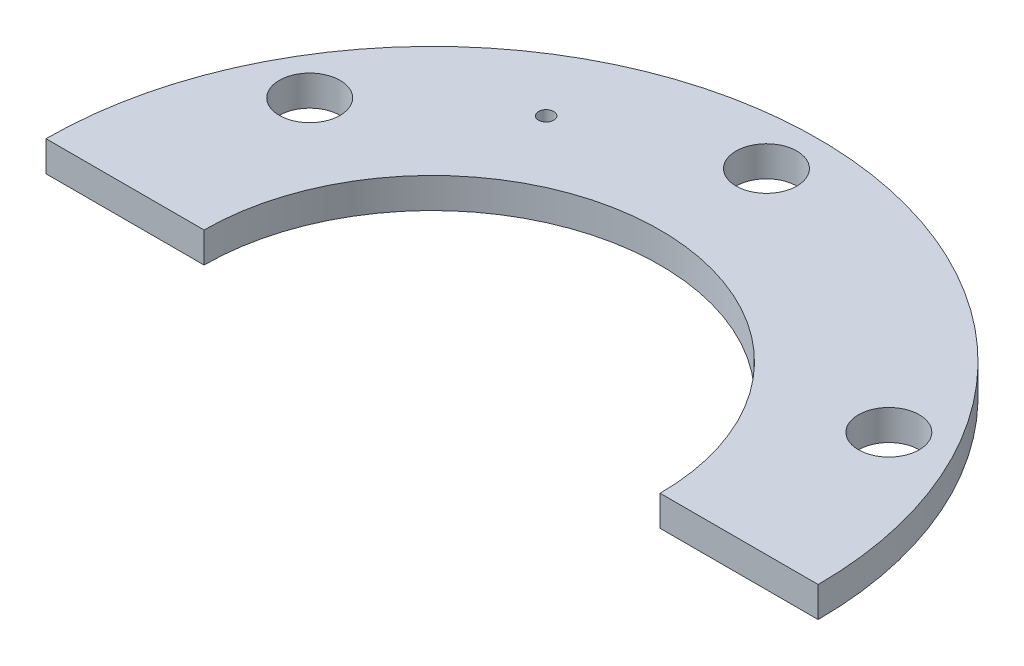
from build123d import *

# Parameters (mm, degrees)
SKETCH1_R               = 12.7
BOSS_EXTRUDE1_DEPTH     = 1
CUT_EXTRUDE1_DEPTH      = 18.98832955
CUT_EXTRUDE1_DEPTH_BACK = 18.98832955
SKETCH19_R              = 1
CUT_EXTRUDE2_DEPTH      = 18.98832955
CUT_EXTRUDE2_DEPTH_BACK = 18.98832955
SKETCH20_R              = 7.5
SKETCH21_W              = 65.874202484
SKETCH21_H              = 51.979273979
CUT_EXTRUDE3_DEPTH      = 18.98832955
CUT_EXTRUDE4_DEPTH      = 18.98832955
CUT_EXTRUDE4_DEPTH_BACK = 18.98832955
SKETCH22_R              = 0.25


with BuildPart() as part:
    # Sketch1 → Boss-Extrude1 (new body)
    with BuildSketch(Plane(origin=(0, 0, 0), x_dir=(1, 0, 0), z_dir=(0, 1, 0))):
        with Locations(Location((0, 0, 0), (0, 0, 270))):
            Circle(SKETCH1_R)
    extrude(amount=BOSS_EXTRUDE1_DEPTH)

    # Sketch19 → Cut-Extrude1 (cut, two sides: drawn at the far end of the back side and taken through both)
    with BuildSketch(Plane(origin=(0, 1, 0), x_dir=(1, 0, 0), z_dir=(0, 1, 0)).offset(-CUT_EXTRUDE1_DEPTH_BACK)):
        with Locations(Location((0, 11, 0), (0, 0, 270))):
            Circle(SKETCH19_R)
        with Locations(Location((9.526279442, 5.5, 0), (0, 0, 270))):
            Circle(SKETCH19_R)
        with Locations(Location((9.526279442, -5.5, 0), (0, 0, 270))):
            Circle(SKETCH19_R)
        with Locations(Location((0, -11, 0), (0, 0, 270))):
            Circle(SKETCH19_R)
        with Locations(Location((-9.526279442, -5.5, 0), (0, 0, 270))):
            Circle(SKETCH19_R)
        with Locations(Location((-9.526279442, 5.5, 0), (0, 0, 270))):
            Circle(SKETCH19_R)
    extrude(amount=CUT_EXTRUDE1_DEPTH + CUT_EXTRUDE1_DEPTH_BACK, mode=Mode.SUBTRACT)

    # Sketch20 → Cut-Extrude2 (cut, two sides: drawn at the far end of the back side and taken through both)
    with BuildSketch(Plane(origin=(0, 1, 0), x_dir=(1, 0, 0), z_dir=(0, 1, 0)).offset(-CUT_EXTRUDE2_DEPTH_BACK)):
        with Locations(Location((0, 0, 0), (0, 0, 270))):
            Circle(SKETCH20_R)
    extrude(amount=CUT_EXTRUDE2_DEPTH + CUT_EXTRUDE2_DEPTH_BACK, mode=Mode.SUBTRACT)

    # Sketch21 → Cut-Extrude3 (cut, through all)
    with BuildSketch(Plane.XY):
        with Locations((-3.816154381, 6.321647006)):
            Rectangle(SKETCH21_W, SKETCH21_H)
    extrude(amount=CUT_EXTRUDE3_DEPTH, mode=Mode.SUBTRACT)

    # Sketch22 → Cut-Extrude4 (cut, two sides: drawn at the far end of the back side and taken through both)
    with BuildSketch(Plane(origin=(0, 1, 0), x_dir=(1, 0, 0), z_dir=(0, 1, 0)).offset(-CUT_EXTRUDE4_DEPTH_BACK)):
        with Locations(Location((-5.125, 8.876760389, 0), (0, 0, 270))):
            Circle(SKETCH22_R)
    extrude(amount=CUT_EXTRUDE4_DEPTH + CUT_EXTRUDE4_DEPTH_BACK, mode=Mode.SUBTRACT)


solid = part.part
